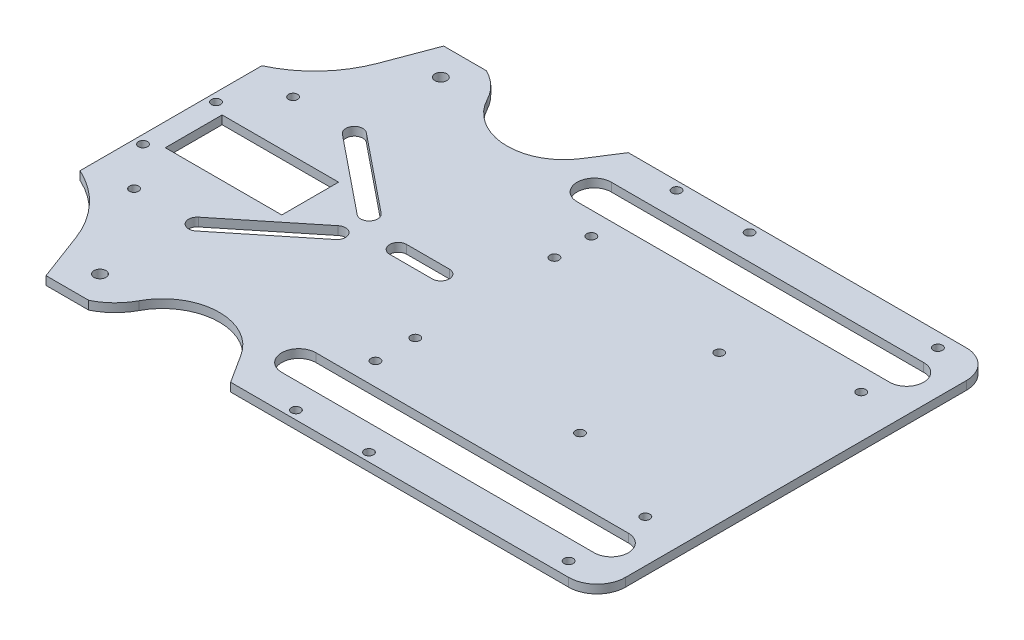
from build123d import *

# Parameters (mm, degrees)
Y_KSEKLIK_EKSTR_ZYON3_DEPTH = 3
KES_EKSTR_ZYON10_DEPTH      = 3
KES_EKSTR_ZYON11_DEPTH      = 3
KES_EKSTR_ZYON14_DEPTH      = 3
KES_EKSTR_ZYON15_DEPTH      = 3
KES_EKSTR_ZYON16_DEPTH      = 3
KES_EKSTR_ZYON17_DEPTH      = 3
KES_EKSTR_ZYON18_DEPTH      = 3
IZIM28_R                    = 1.6
KES_EKSTR_ZYON19_DEPTH      = 3
IZIM29_R                    = 1.6
KES_EKSTR_ZYON20_DEPTH      = 3
IZIM30_R                    = 1.6
KES_EKSTR_ZYON21_DEPTH      = 3
IZIM31_W                    = 41
IZIM31_H                    = 20
KES_EKSTR_ZYON22_DEPTH      = 10
IZIM32_R                    = 1.6
KES_EKSTR_ZYON23_DEPTH      = 10
KES_EKSTR_ZYON24_DEPTH      = 10
IZIM34_R                    = 2.1
KES_EKSTR_ZYON25_DEPTH      = 3
IZIM35_R                    = 1.6
KES_EKSTR_ZYON26_DEPTH      = 45
IZIM36_R                    = 1.6
KES_EKSTR_ZYON27_DEPTH      = 45


with BuildPart() as part:
    # Çizim16 → Yükseklik-Ekstrüzyon3 (new body)
    with BuildSketch(Plane(origin=(0, 0, 0), x_dir=(1, 0, 0), z_dir=(0, 1, 0))):
        with BuildLine():
            Line((-110, -70), (100, -70))
            ThreePointArc((100, -70), (107.071067812, -67.071067812), (110, -60))
            Line((110, -60), (110, 60))
            ThreePointArc((110, 60), (107.071067812, 67.071067812), (100, 70))
            Line((100, 70), (-110, 70))
            Line((-110, 70), (-110, -70))
        make_face()
    extrude(amount=Y_KSEKLIK_EKSTR_ZYON3_DEPTH)

    # Çizim18 → Kes-Ekstrüzyon10 (cut)
    with BuildSketch(Plane(origin=(0, 3, 0), x_dir=(1, 0, 0), z_dir=(0, 1, 0))):
        with BuildLine():
            Line((-19, 70), (-25.463821511, 59.889658192))
            ThreePointArc((-25.463821511, 59.889658192), (-43.144058736, 50.67991016), (-60, 61.323569832))
            ThreePointArc((-60, 61.323569832), (-63.804672609, 66.383043129), (-69, 70))
            Line((-69, 70), (-19, 70))
        make_face()
    extrude(amount=-KES_EKSTR_ZYON10_DEPTH, mode=Mode.SUBTRACT)

    # Çizim19 → Kes-Ekstrüzyon11 (cut)
    with BuildSketch(Plane(origin=(0, 3, 0), x_dir=(1, 0, 0), z_dir=(0, 1, 0))):
        with BuildLine():
            Line((-19, -70), (-25.463821511, -59.889658192))
            ThreePointArc((-25.463821511, -59.889658192), (-43.144058736, -50.67991016), (-60, -61.323569832))
            ThreePointArc((-60, -61.323569832), (-63.804672609, -66.383043129), (-69, -70))
            Line((-69, -70), (-19, -70))
        make_face()
    extrude(amount=-KES_EKSTR_ZYON11_DEPTH, mode=Mode.SUBTRACT)

    # Çizim23 → Kes-Ekstrüzyon14 (cut)
    with BuildSketch(Plane(origin=(0, 3, 0), x_dir=(1, 0, 0), z_dir=(0, 1, 0))):
        with BuildLine():
            Line((-84, -70), (-90.329717397, -53.149638649))
            ThreePointArc((-90.329717397, -53.149638649), (-98.077113424, -40.633105793), (-110, -32))
            Line((-110, -32), (-110, -70))
            Line((-110, -70), (-84, -70))
        make_face()
    extrude(amount=-KES_EKSTR_ZYON14_DEPTH, mode=Mode.SUBTRACT)

    # Çizim24 → Kes-Ekstrüzyon15 (cut)
    with BuildSketch(Plane(origin=(0, 3, 0), x_dir=(1, 0, 0), z_dir=(0, 1, 0))):
        with BuildLine():
            Line((-84, 70), (-90.329717397, 53.149638649))
            ThreePointArc((-90.329717397, 53.149638649), (-98.077113424, 40.633105793), (-110, 32))
            Line((-110, 32), (-110, 70))
            Line((-110, 70), (-84, 70))
        make_face()
    extrude(amount=-KES_EKSTR_ZYON15_DEPTH, mode=Mode.SUBTRACT)

    # Çizim25 → Kes-Ekstrüzyon16 (cut)
    with BuildSketch(Plane(origin=(0, 3, 0), x_dir=(1, 0, 0), z_dir=(0, 1, 0))):
        with BuildLine():
            Line((-44.007256251, -8), (-71.228571429, -30))
            ThreePointArc((-71.228571429, -30), (-75.447541301, -29.552458699), (-75, -25.333488827))
            Line((-75, -25.333488827), (-47.778684822, -3.333488827))
            ThreePointArc((-47.778684822, -3.333488827), (-43.55971495, -3.781030128), (-44.007256251, -8))
        make_face()
    extrude(amount=-KES_EKSTR_ZYON16_DEPTH, mode=Mode.SUBTRACT)

    # Çizim26 → Kes-Ekstrüzyon17 (cut)
    with BuildSketch(Plane(origin=(0, 3, 0), x_dir=(1, 0, 0), z_dir=(0, 1, 0))):
        with BuildLine():
            Line((-71.228571429, 30), (-44.007256251, 8))
            ThreePointArc((-44.007256251, 8), (-43.55971495, 3.781030128), (-47.778684822, 3.333488827))
            Line((-47.778684822, 3.333488827), (-75, 25.333488827))
            ThreePointArc((-75, 25.333488827), (-75.447541301, 29.552458699), (-71.228571429, 30))
        make_face()
    extrude(amount=-KES_EKSTR_ZYON17_DEPTH, mode=Mode.SUBTRACT)

    # Çizim27 → Kes-Ekstrüzyon18 (cut)
    with BuildSketch(Plane(origin=(0, 3, 0), x_dir=(1, 0, 0), z_dir=(0, 1, 0))):
        with BuildLine():
            Line((-15, -3), (-30, -3))
            ThreePointArc((-30, -3), (-33, 0), (-30, 3))
            Line((-30, 3), (-15, 3))
            ThreePointArc((-15, 3), (-12, 0), (-15, -3))
        make_face()
    extrude(amount=-KES_EKSTR_ZYON18_DEPTH, mode=Mode.SUBTRACT)

    # Çizim28 → Kes-Ekstrüzyon19 (cut)
    with BuildSketch(Plane(origin=(0, 3, 0), x_dir=(1, 0, 0), z_dir=(0, 1, 0))):
        with Locations(Location((1, -67, 0), (0, 0, 270))):
            Circle(IZIM28_R)
        with Locations(Location((26.7, -67, 0), (0, 0, 270))):
            Circle(IZIM28_R)
    extrude(amount=-KES_EKSTR_ZYON19_DEPTH, mode=Mode.SUBTRACT)

    # Çizim29 → Kes-Ekstrüzyon20 (cut)
    with BuildSketch(Plane(origin=(0, 3, 0), x_dir=(1, 0, 0), z_dir=(0, 1, 0))):
        with Locations(Location((-107, 12.85, 0), (0, 0, 270))):
            Circle(IZIM29_R)
        with Locations(Location((-107, -12.85, 0), (0, 0, 270))):
            Circle(IZIM29_R)
    extrude(amount=-KES_EKSTR_ZYON20_DEPTH, mode=Mode.SUBTRACT)

    # Çizim30 → Kes-Ekstrüzyon21 (cut)
    with BuildSketch(Plane(origin=(0, 3, 0), x_dir=(1, 0, 0), z_dir=(0, 1, 0))):
        with Locations(Location((1, 67, 0), (0, 0, 270))):
            Circle(IZIM30_R)
        with Locations(Location((26.7, 67, 0), (0, 0, 270))):
            Circle(IZIM30_R)
    extrude(amount=-KES_EKSTR_ZYON21_DEPTH, mode=Mode.SUBTRACT)

    # Çizim31 → Kes-Ekstrüzyon22 (cut)
    with BuildSketch(Plane(origin=(0, 3, 0), x_dir=(1, 0, 0), z_dir=(0, 1, 0))):
        with Locations((-81.5, 0)):
            Rectangle(IZIM31_W, IZIM31_H)
    extrude(amount=-KES_EKSTR_ZYON22_DEPTH, mode=Mode.SUBTRACT)

    # Çizim32 → Kes-Ekstrüzyon23 (cut)
    with BuildSketch(Plane(origin=(0, 3, 0), x_dir=(1, 0, 0), z_dir=(0, 1, 0))):
        with Locations(Location((95, -65, 0), (0, 0, 270))):
            Circle(IZIM32_R)
        with Locations(Location((95, 65, 0), (0, 0, 270))):
            Circle(IZIM32_R)
        with Locations(Location((-95, -28, 0), (0, 0, 270))):
            Circle(IZIM32_R)
        with Locations(Location((-95, 28, 0), (0, 0, 270))):
            Circle(IZIM32_R)
    extrude(amount=-KES_EKSTR_ZYON23_DEPTH, mode=Mode.SUBTRACT)

    # Çizim33 → Kes-Ekstrüzyon24 (cut)
    with BuildSketch(Plane(origin=(0, 3, 0), x_dir=(1, 0, 0), z_dir=(0, 1, 0))):
        with BuildLine():
            Line((97, 46), (-13, 46))
            ThreePointArc((-13, 46), (-19, 52), (-13, 58))
            Line((-13, 58), (97, 58))
            ThreePointArc((97, 58), (103, 52), (97, 46))
        make_face()
        with BuildLine():
            Line((-13, -46), (97, -46))
            ThreePointArc((97, -46), (103, -52), (97, -58))
            Line((97, -58), (-13, -58))
            ThreePointArc((-13, -58), (-19, -52), (-13, -46))
        make_face()
    extrude(amount=-KES_EKSTR_ZYON24_DEPTH, mode=Mode.SUBTRACT)

    # Çizim34 → Kes-Ekstrüzyon25 (cut)
    with BuildSketch(Plane(origin=(0, 3, 0), x_dir=(1, 0, 0), z_dir=(0, 1, 0))):
        with Locations(Location((-75, -60, 0), (0, 0, 270))):
            Circle(IZIM34_R)
        with Locations(Location((-75, 60, 0), (0, 0, 270))):
            Circle(IZIM34_R)
    extrude(amount=-KES_EKSTR_ZYON25_DEPTH, mode=Mode.SUBTRACT)

    # Çizim35 → Kes-Ekstrüzyon26 (cut)
    with BuildSketch(Plane(origin=(0, 3, 0), x_dir=(1, 0, 0), z_dir=(0, 1, 0))):
        with Locations(Location((95, -38, 0), (0, 0, 270))):
            Circle(IZIM35_R)
        with Locations(Location((95, 38, 0), (0, 0, 270))):
            Circle(IZIM35_R)
        with Locations(Location((0, 38, 0), (0, 0, 270))):
            Circle(IZIM35_R)
        with Locations(Location((0, -38, 0), (0, 0, 270))):
            Circle(IZIM35_R)
    extrude(amount=-KES_EKSTR_ZYON26_DEPTH, mode=Mode.SUBTRACT)

    # Çizim36 → Kes-Ekstrüzyon27 (cut)
    with BuildSketch(Plane(origin=(0, 3, 0), x_dir=(1, 0, 0), z_dir=(0, 1, 0))):
        with Locations(Location((0, 25, 0), (0, 0, 270))):
            Circle(IZIM36_R)
        with Locations(Location((58, 25, 0), (0, 0, 270))):
            Circle(IZIM36_R)
        with Locations(Location((0, -24, 0), (0, 0, 270))):
            Circle(IZIM36_R)
        with Locations(Location((58, -24, 0), (0, 0, 270))):
            Circle(IZIM36_R)
    extrude(amount=-KES_EKSTR_ZYON27_DEPTH, mode=Mode.SUBTRACT)


solid = part.part
